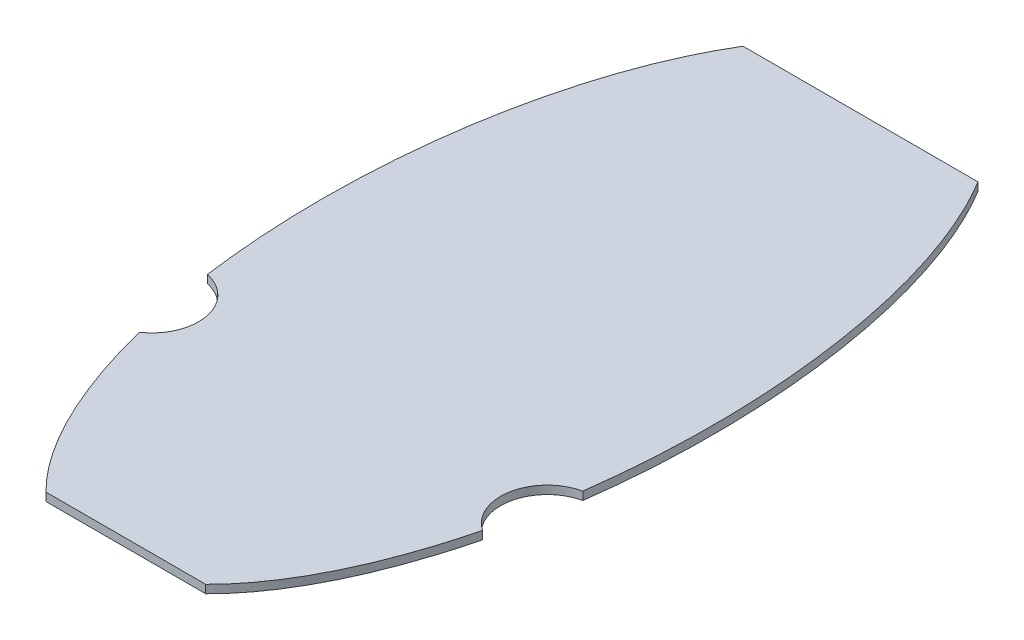
from build123d import *

# Parameters (mm, degrees)
BOSS_EXTRUDE1_DEPTH = 0.5588
SKETCH2_R           = 3.175
CUT_EXTRUDE3_DEPTH  = 30.823202218


with BuildPart() as part:
    # Sketch1 → Boss-Extrude1 (new body)
    with BuildSketch(Plane(origin=(0, 0, 0), x_dir=(1, 0, 0), z_dir=(0, 1, 0))):
        with BuildLine():
            Line((-5.43884297, -26.67), (5.43884297, -26.67))
            add(Edge.make_bspline(
                [(5.43884297, -26.67), (26.133188211, -6.420594918), (8.001, 23.368)],
                knots=[0.420111478, 0.420111478, 0.420111478, 2.498091545, 2.498091545, 2.498091545], degree=2, weights=[1, 0.507090998, 1]))
            Line((8.001, 23.368), (-8.001, 23.368))
            add(Edge.make_bspline(
                [(-8.001, 23.368), (-26.133188211, -6.420594918), (-5.43884297, -26.67)],
                knots=[3.785093762, 3.785093762, 3.785093762, 5.863073829, 5.863073829, 5.863073829], degree=2, weights=[1, 0.507090998, 1]))
        make_face()
    extrude(amount=BOSS_EXTRUDE1_DEPTH)

    # Sketch2 → Cut-Extrude3 (cut, through all)
    with BuildSketch(Plane(origin=(0, 0, 0), x_dir=(1, 0, 0), z_dir=(0, 1, 0))):
        with Locations((-13.462, -11.43)):
            Circle(SKETCH2_R)
        with Locations((13.462, -11.43)):
            Circle(SKETCH2_R)
    extrude(amount=CUT_EXTRUDE3_DEPTH, mode=Mode.SUBTRACT)


solid = part.part
